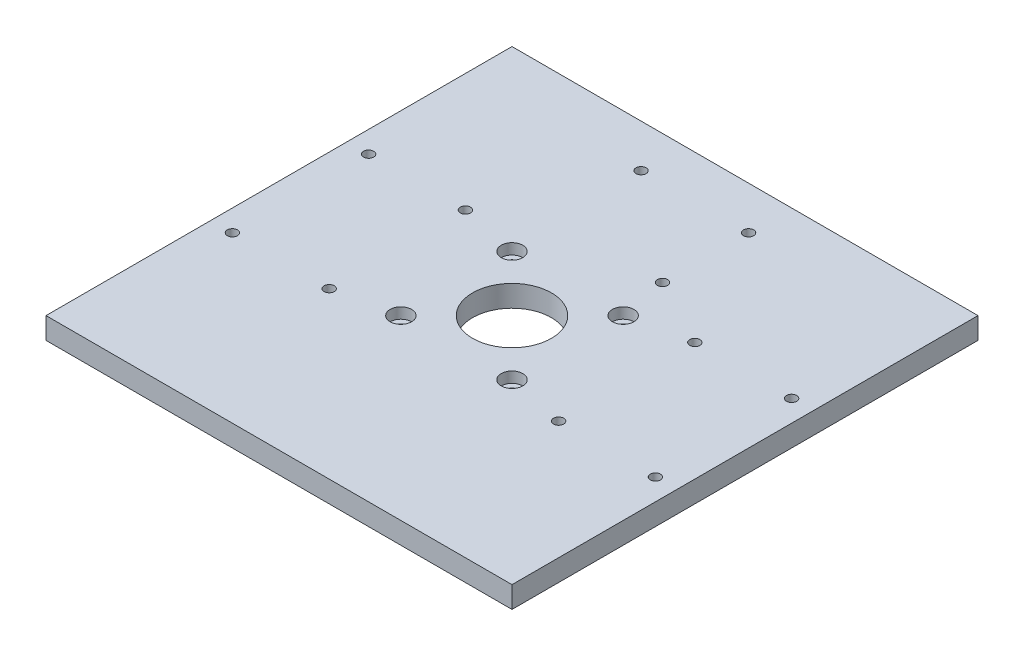
from build123d import *

# Parameters (mm, degrees)
SKETCH1_W           = 130
SKETCH1_H           = 130
SKETCH1_R           = 11
BOSS_EXTRUDE1_DEPTH = 6
SKETCH2_R           = 1.42
CUT_EXTRUDE1_DEPTH  = 6
SKETCH3_R           = 3
CUT_EXTRUDE2_DEPTH  = 3
SKETCH4_R           = 1.42
CUT_EXTRUDE3_DEPTH  = 10
SKETCH5_R           = 1.42
CUT_EXTRUDE4_DEPTH  = 10


with BuildPart() as part:
    # Sketch1 → Boss-Extrude1 (new body)
    with BuildSketch(Plane(origin=(0, 0, 0), x_dir=(1, 0, 0), z_dir=(0, 1, 0))):
        Rectangle(SKETCH1_W, SKETCH1_H)
        with Locations(Location((0, 0, 0), (0, 0, 270))):
            Circle(SKETCH1_R, mode=Mode.SUBTRACT)
    extrude(amount=BOSS_EXTRUDE1_DEPTH)

    # Sketch2 → Cut-Extrude1 (cut)
    with BuildSketch(Plane(origin=(0, 6, 0), x_dir=(1, 0, 0), z_dir=(0, 1, 0))):
        with Locations(Location((-15.5, 15.5, 0), (0, 0, 270))):
            Circle(SKETCH2_R)
        with Locations(Location((15.5, 15.5, 0), (0, 0, 270))):
            Circle(SKETCH2_R)
        with Locations(Location((15.5, -15.5, 0), (0, 0, 270))):
            Circle(SKETCH2_R)
        with Locations(Location((-15.5, -15.5, 0), (0, 0, 270))):
            Circle(SKETCH2_R)
    extrude(amount=-CUT_EXTRUDE1_DEPTH, mode=Mode.SUBTRACT)

    # Sketch3 → Cut-Extrude2 (cut)
    with BuildSketch(Plane(origin=(0, 6, 0), x_dir=(1, 0, 0), z_dir=(0, 1, 0))):
        with Locations(Location((-15.5, 15.5, 0), (0, 0, 270))):
            Circle(SKETCH3_R)
        with Locations(Location((15.5, 15.5, 0), (0, 0, 270))):
            Circle(SKETCH3_R)
        with Locations(Location((15.5, -15.5, 0), (0, 0, 270))):
            Circle(SKETCH3_R)
        with Locations(Location((-15.5, -15.5, 0), (0, 0, 270))):
            Circle(SKETCH3_R)
    extrude(amount=-CUT_EXTRUDE2_DEPTH, mode=Mode.SUBTRACT)

    # Sketch4 → Cut-Extrude3 (cut)
    with BuildSketch(Plane(origin=(0, 6, 0), x_dir=(1, 0, 0), z_dir=(0, 1, 0))):
        with Locations(Location((-59, 19, 0), (0, 0, 270))):
            Circle(SKETCH4_R)
        with Locations(Location((-32, 19, 0), (0, 0, 270))):
            Circle(SKETCH4_R)
        with Locations(Location((-32, -19, 0), (0, 0, 270))):
            Circle(SKETCH4_R)
        with Locations(Location((-59, -19, 0), (0, 0, 270))):
            Circle(SKETCH4_R)
        with Locations(Location((59, 19, 0), (0, 0, 90))):
            Circle(SKETCH4_R)
        with Locations(Location((59, -19, 0), (0, 0, 90))):
            Circle(SKETCH4_R)
        with Locations(Location((32, -19, 0), (0, 0, 90))):
            Circle(SKETCH4_R)
        with Locations(Location((32, 19, 0), (0, 0, 90))):
            Circle(SKETCH4_R)
    extrude(amount=-CUT_EXTRUDE3_DEPTH, mode=Mode.SUBTRACT)

    # Sketch5 → Cut-Extrude4 (cut)
    with BuildSketch(Plane(origin=(0, 6, 0), x_dir=(1, 0, 0), z_dir=(0, 1, 0))):
        with Locations(Location((13, 53, 0), (0, 0, 270))):
            Circle(SKETCH5_R)
        with Locations(Location((-17, 53, 0), (0, 0, 270))):
            Circle(SKETCH5_R)
        with Locations(Location((13, 29, 0), (0, 0, 270))):
            Circle(SKETCH5_R)
    extrude(amount=-CUT_EXTRUDE4_DEPTH, mode=Mode.SUBTRACT)


solid = part.part
